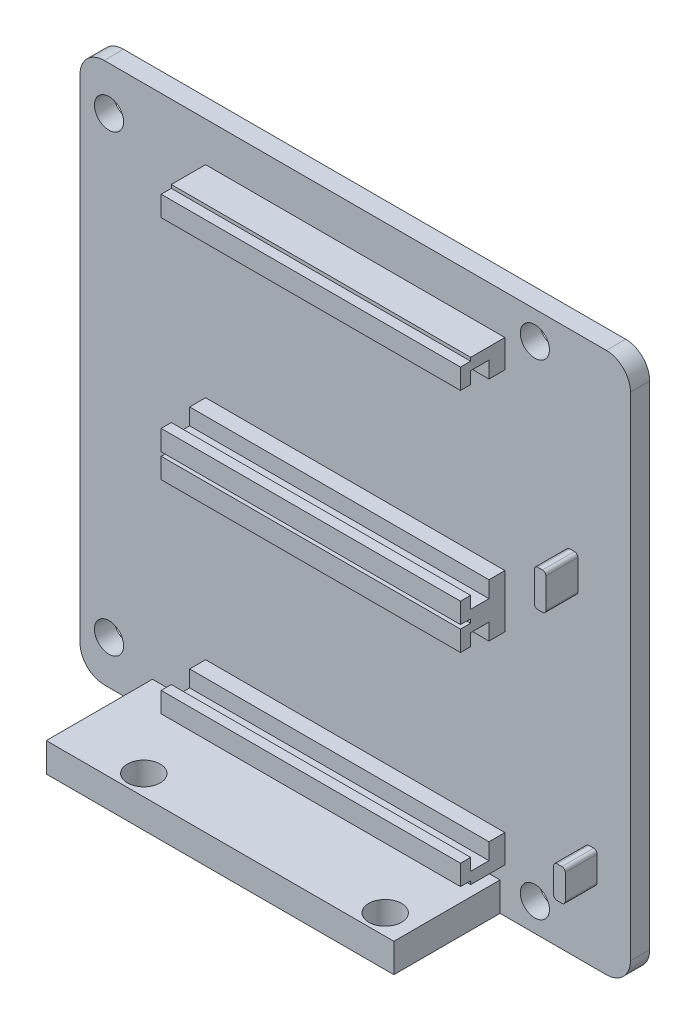
from build123d import *

# Parameters (mm, degrees)
VERTICAL_CARRIER_2MM_SKETCH_R  = 1.51
VERTICAL_CARRIER_2MM_DEPTH     = 2
INTEGRAL_FOOT_3MM_START        = 2
INTEGRAL_FOOT_3MM_SKETCH_W     = 36
INTEGRAL_FOOT_3MM_SKETCH_H     = 3
INTEGRAL_FOOT_3MM_DEPTH        = 11
FOOT_2X_D3P4_ISO273_START      = -28
FOOT_2X_D3P4_ISO273_SKETCH_R   = 1.7
FOOT_2X_D3P4_ISO273_DEPTH      = 3
BUCK_UNDERSIDE_RAILS_START     = 2
BUCK_UNDERSIDE_RAILS_SKETCH_W  = 31
BUCK_UNDERSIDE_RAILS_SKETCH_H  = 2
BUCK_UNDERSIDE_RAILS_DEPTH     = 1.65
BUCK_EDGE_GUIDES_START         = 2
BUCK_EDGE_GUIDES_SKETCH_W      = 31
BUCK_EDGE_GUIDES_SKETCH_H      = 1.2
BUCK_EDGE_GUIDES_DEPTH         = 3.55
BUCK_SLIDE_IN_LIPS_START       = 5.55
BUCK_SLIDE_IN_LIPS_SKETCH_W    = 31
BUCK_SLIDE_IN_LIPS_SKETCH_H    = 2.1
BUCK_SLIDE_IN_LIPS_DEPTH       = 1.05
RS485_UNDERSIDE_RAILS_START    = 2
RS485_UNDERSIDE_RAILS_SKETCH_W = 31
RS485_UNDERSIDE_RAILS_SKETCH_H = 2
RS485_UNDERSIDE_RAILS_DEPTH    = 1.65
RS485_EDGE_GUIDES_START        = 2
RS485_EDGE_GUIDES_SKETCH_W     = 31
RS485_EDGE_GUIDES_SKETCH_H     = 1.2
RS485_EDGE_GUIDES_DEPTH        = 3.55
RS485_SLIDE_IN_LIPS_START      = 5.55
RS485_SLIDE_IN_LIPS_SKETCH_W   = 31
RS485_SLIDE_IN_LIPS_SKETCH_H   = 2.1
RS485_SLIDE_IN_LIPS_DEPTH      = 1.05
PCB_INSERTION_STOPS_START      = 2
PCB_INSERTION_STOPS_DEPTH      = 3.3


with BuildPart() as part:
    # Vertical_carrier_2mm_Sketch → Vertical_carrier_2mm (new body)
    with BuildSketch(Plane.XY):
        with BuildLine():
            Line((-26, -28), (26, -28))
            ThreePointArc((26, -28), (27.767766953, -27.267766953), (28.5, -25.5))
            Line((28.5, -25.5), (28.5, 25.5))
            ThreePointArc((28.5, 25.5), (27.767766953, 27.267766953), (26, 28))
            Line((26, 28), (-26, 28))
            ThreePointArc((-26, 28), (-27.767766953, 27.267766953), (-28.5, 25.5))
            Line((-28.5, 25.5), (-28.5, -25.5))
            ThreePointArc((-28.5, -25.5), (-27.767766953, -27.267766953), (-26, -28))
        make_face()
        with Locations((-25.5, -23.5)):
            Circle(VERTICAL_CARRIER_2MM_SKETCH_R, mode=Mode.SUBTRACT)
        with Locations((18.6, -25.1)):
            Circle(VERTICAL_CARRIER_2MM_SKETCH_R, mode=Mode.SUBTRACT)
        with Locations((-25.5, 23.5)):
            Circle(VERTICAL_CARRIER_2MM_SKETCH_R, mode=Mode.SUBTRACT)
        with Locations((18.6, 25.1)):
            Circle(VERTICAL_CARRIER_2MM_SKETCH_R, mode=Mode.SUBTRACT)
    extrude(amount=VERTICAL_CARRIER_2MM_DEPTH)

    # Integral_foot_3mm_Sketch → Integral_foot_3mm (add)
    with BuildSketch(Plane.XY.offset(INTEGRAL_FOOT_3MM_START)):
        with Locations((-3, -26.5)):
            Rectangle(INTEGRAL_FOOT_3MM_SKETCH_W, INTEGRAL_FOOT_3MM_SKETCH_H)
    extrude(amount=INTEGRAL_FOOT_3MM_DEPTH)

    # Foot_2x_D3p4_ISO273_Sketch → Foot_2x_D3p4_ISO273 (cut)
    with BuildSketch(Plane(origin=(0, 0, 0), x_dir=(1, 0, 0), z_dir=(0, 1, 0)).offset(FOOT_2X_D3P4_ISO273_START)):
        with Locations(Location((-13, -10.9, 0), (0, 0, 270))):
            Circle(FOOT_2X_D3P4_ISO273_SKETCH_R)
        with Locations(Location((12, -10.9, 0), (0, 0, 270))):
            Circle(FOOT_2X_D3P4_ISO273_SKETCH_R)
    extrude(amount=FOOT_2X_D3P4_ISO273_DEPTH, mode=Mode.SUBTRACT)

    # Buck_underside_rails_Sketch → Buck_underside_rails (add)
    with BuildSketch(Plane.XY.offset(BUCK_UNDERSIDE_RAILS_START)):
        with Locations((0, 2)):
            Rectangle(BUCK_UNDERSIDE_RAILS_SKETCH_W, BUCK_UNDERSIDE_RAILS_SKETCH_H)
        with Locations((0, 22)):
            Rectangle(BUCK_UNDERSIDE_RAILS_SKETCH_W, BUCK_UNDERSIDE_RAILS_SKETCH_H)
    extrude(amount=BUCK_UNDERSIDE_RAILS_DEPTH)

    # Buck_edge_guides_Sketch → Buck_edge_guides (add)
    with BuildSketch(Plane.XY.offset(BUCK_EDGE_GUIDES_START)):
        with Locations((0, 0.7)):
            Rectangle(BUCK_EDGE_GUIDES_SKETCH_W, BUCK_EDGE_GUIDES_SKETCH_H)
        with Locations((0, 23.3)):
            Rectangle(BUCK_EDGE_GUIDES_SKETCH_W, BUCK_EDGE_GUIDES_SKETCH_H)
    extrude(amount=BUCK_EDGE_GUIDES_DEPTH)

    # Buck_slide_in_lips_Sketch → Buck_slide_in_lips (add)
    with BuildSketch(Plane.XY.offset(BUCK_SLIDE_IN_LIPS_START)):
        with Locations((0, 1.5)):
            Rectangle(BUCK_SLIDE_IN_LIPS_SKETCH_W, BUCK_SLIDE_IN_LIPS_SKETCH_H)
        with Locations((0, 22.5)):
            Rectangle(BUCK_SLIDE_IN_LIPS_SKETCH_W, BUCK_SLIDE_IN_LIPS_SKETCH_H)
    extrude(amount=BUCK_SLIDE_IN_LIPS_DEPTH)

    # RS485_underside_rails_Sketch → RS485_underside_rails (add)
    with BuildSketch(Plane.XY.offset(RS485_UNDERSIDE_RAILS_START)):
        with Locations((0, -21.5)):
            Rectangle(RS485_UNDERSIDE_RAILS_SKETCH_W, RS485_UNDERSIDE_RAILS_SKETCH_H)
        with Locations((0, -1.5)):
            Rectangle(RS485_UNDERSIDE_RAILS_SKETCH_W, RS485_UNDERSIDE_RAILS_SKETCH_H)
    extrude(amount=RS485_UNDERSIDE_RAILS_DEPTH)

    # RS485_edge_guides_Sketch → RS485_edge_guides (add)
    with BuildSketch(Plane.XY.offset(RS485_EDGE_GUIDES_START)):
        with Locations((0, -22.8)):
            Rectangle(RS485_EDGE_GUIDES_SKETCH_W, RS485_EDGE_GUIDES_SKETCH_H)
        with Locations((0, -0.2)):
            Rectangle(RS485_EDGE_GUIDES_SKETCH_W, RS485_EDGE_GUIDES_SKETCH_H)
    extrude(amount=RS485_EDGE_GUIDES_DEPTH)

    # RS485_slide_in_lips_Sketch → RS485_slide_in_lips (add)
    with BuildSketch(Plane.XY.offset(RS485_SLIDE_IN_LIPS_START)):
        with Locations((0, -22)):
            Rectangle(RS485_SLIDE_IN_LIPS_SKETCH_W, RS485_SLIDE_IN_LIPS_SKETCH_H)
        with Locations((0, -1)):
            Rectangle(RS485_SLIDE_IN_LIPS_SKETCH_W, RS485_SLIDE_IN_LIPS_SKETCH_H)
    extrude(amount=RS485_SLIDE_IN_LIPS_DEPTH)

    # PCB_insertion_stops_Sketch → PCB_insertion_stops (add)
    with BuildSketch(Plane.XY.offset(PCB_INSERTION_STOPS_START)):
        with BuildLine():
            Line((22.2, 4.5), (22.7, 4.5))
            ThreePointArc((22.7, 4.5), (22.947487373, 4.602512627), (23.05, 4.85))
            Line((23.05, 4.85), (23.05, 7.95))
            ThreePointArc((23.05, 7.95), (22.947487373, 8.197487373), (22.7, 8.3))
            Line((22.7, 8.3), (22.2, 8.3))
            ThreePointArc((22.2, 8.3), (21.952512627, 8.197487373), (21.85, 7.95))
            Line((21.85, 7.95), (21.85, 4.85))
            ThreePointArc((21.85, 4.85), (21.952512627, 4.602512627), (22.2, 4.5))
        make_face()
        with BuildLine():
            Line((24.2, -20.6), (24.7, -20.6))
            ThreePointArc((24.7, -20.6), (24.947487373, -20.497487373), (25.05, -20.25))
            Line((25.05, -20.25), (25.05, -17.65))
            ThreePointArc((25.05, -17.65), (24.947487373, -17.402512627), (24.7, -17.3))
            Line((24.7, -17.3), (24.2, -17.3))
            ThreePointArc((24.2, -17.3), (23.952512627, -17.402512627), (23.85, -17.65))
            Line((23.85, -17.65), (23.85, -20.25))
            ThreePointArc((23.85, -20.25), (23.952512627, -20.497487373), (24.2, -20.6))
        make_face()
    extrude(amount=PCB_INSERTION_STOPS_DEPTH)


solid = part.part
